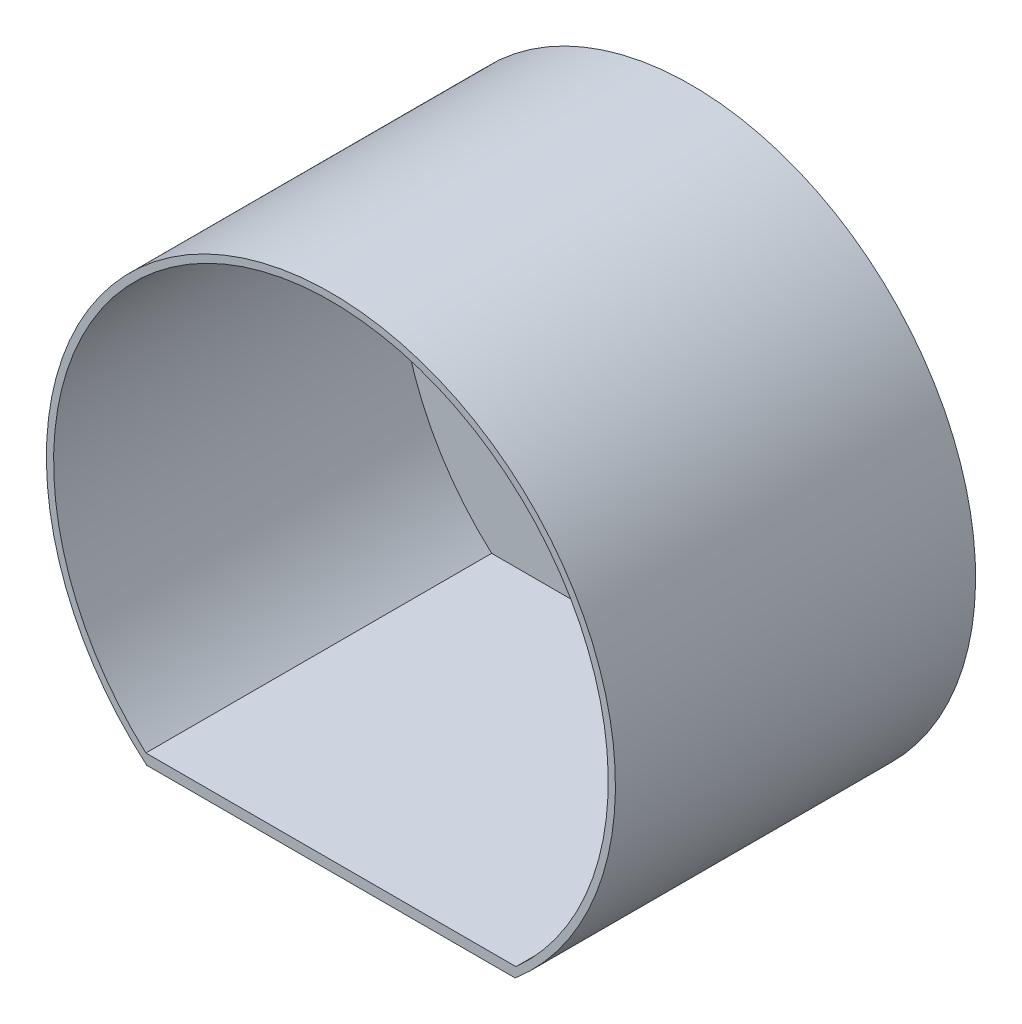
from build123d import *

# Parameters (mm, degrees)
BOSS_EXTRUDE1_DEPTH = 50
BOSS_EXTRUDE2_DEPTH = 2
SKETCH3_R           = 6
CUT_EXTRUDE1_DEPTH  = 2
SKETCH4_R           = 6
CUT_EXTRUDE2_DEPTH  = 2
BOSS_EXTRUDE3_START = 20
SKETCH5_R           = 9
SKETCH5_R_2         = 6
BOSS_EXTRUDE3_DEPTH = 20


with BuildPart() as part:
    # Sketch1 → Boss-Extrude1 (new body)
    with BuildSketch(Plane.XY):
        with BuildLine():
            Line((-25.576977383, -30.100967226), (25.576977383, -30.100967226))
            ThreePointArc((25.576977383, -30.100967226), (0, 39.5), (-25.576977383, -30.100967226))
        make_face()
        with BuildLine():
            Line((-25.687078778, -28.677935488), (25.687078778, -28.677935488))
            ThreePointArc((25.687078778, -28.677935488), (0, 38.5), (-25.687078778, -28.677935488))
        make_face(mode=Mode.SUBTRACT)
    extrude(amount=BOSS_EXTRUDE1_DEPTH)

    # Sketch2 → Boss-Extrude2 (add)
    with BuildSketch(Plane(origin=(0, 0, 0), x_dir=(-1, 0, 0), z_dir=(0, 0, -1))):
        with BuildLine():
            Line((25.687078778, -28.677935488), (-25.687078778, -28.677935488))
            ThreePointArc((-25.687078778, -28.677935488), (0, 38.5), (25.687078778, -28.677935488))
        make_face()
    extrude(amount=-BOSS_EXTRUDE2_DEPTH)

    # Sketch3 → Cut-Extrude1 (cut)
    with BuildSketch(Plane(origin=(0, 0, 0), x_dir=(-1, 0, 0), z_dir=(0, 0, -1))):
        Circle(SKETCH3_R)
    extrude(amount=-CUT_EXTRUDE1_DEPTH, mode=Mode.SUBTRACT)

    # Sketch4 → Cut-Extrude2 (cut)
    with BuildSketch(Plane(origin=(0, 0, 0), x_dir=(-1, 0, 0), z_dir=(0, 0, -1))):
        with Locations((0, 18)):
            Circle(SKETCH4_R)
    extrude(amount=-CUT_EXTRUDE2_DEPTH, mode=Mode.SUBTRACT)

    # Sketch5 → Boss-Extrude3 (add)
    with BuildSketch(Plane(origin=(0, 0, 0), x_dir=(-1, 0, 0), z_dir=(0, 0, -1)).offset(BOSS_EXTRUDE3_START)):
        with Locations(Location((0, 0, 0), (0, 0, 180))):
            Circle(SKETCH5_R)
        Circle(SKETCH5_R_2, mode=Mode.SUBTRACT)
    extrude(amount=-BOSS_EXTRUDE3_DEPTH)


solid = part.part
